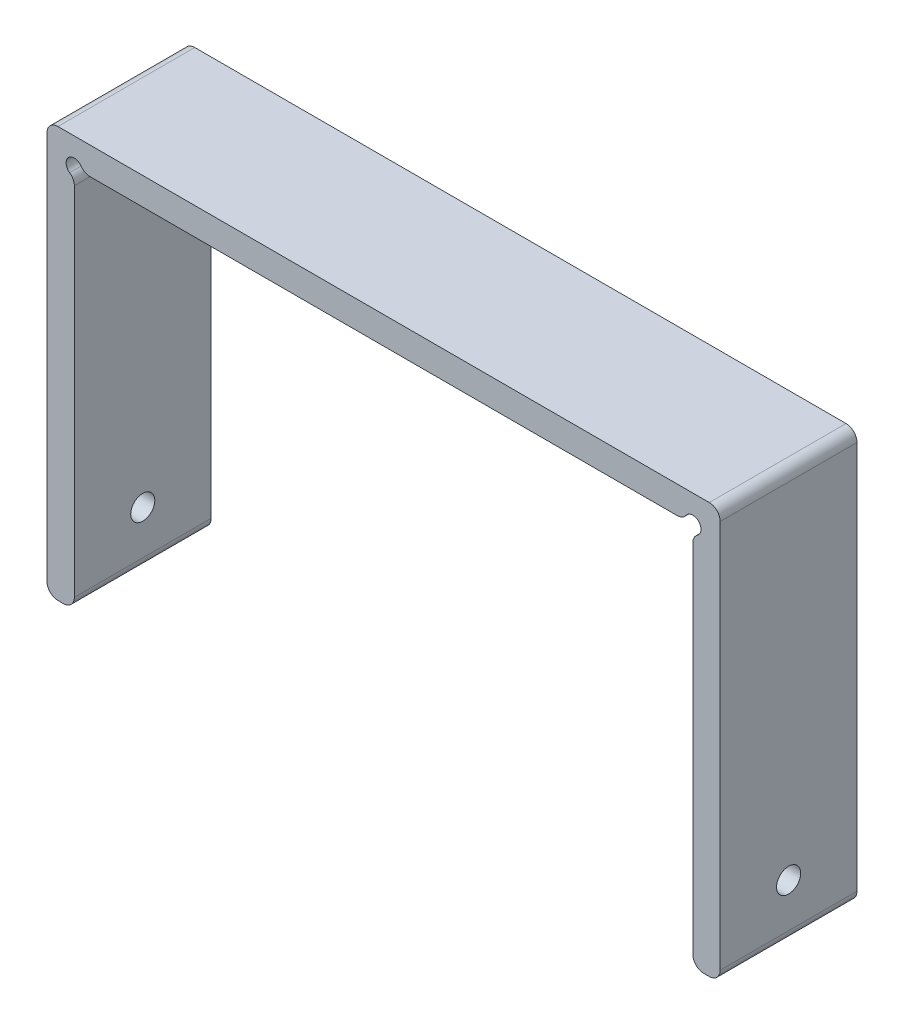
from build123d import *

# Parameters (mm, degrees)
EXTRUDE_1_DEPTH     = 25
SKETCH_2_R          = 2.2
CUT_EXTRUDE_2_DEPTH = 147.215594244
SKETCH_3_R          = 1.5
CUT_EXTRUDE_3_DEPTH = 147.215594244
FILLET_1_R          = 2


with BuildPart() as part:
    # ｽｹｯﾁ1 → ﾎﾞｽ - 押し出し1 (new body)
    with BuildSketch(Plane.XY):
        Polygon((0, 0), (0, 75), (123, 75), (123, 0), (118, 0), (118, 70), (5, 70), (5, 0), align=None)
    extrude(amount=EXTRUDE_1_DEPTH)

    # ｽｹｯﾁ2 → ｶｯﾄ - 押し出し2 (cut, through all)
    with BuildSketch(Plane(origin=(123, 0, 0), x_dir=(0, 0, -1), z_dir=(1, 0, 0))):
        with Locations((-12.5, 10)):
            Circle(SKETCH_2_R)
    extrude(amount=-CUT_EXTRUDE_2_DEPTH, mode=Mode.SUBTRACT)

    # ｽｹｯﾁ3 → ｶｯﾄ - 押し出し3 (cut, through all)
    with BuildSketch(Plane.XY.offset(25)):
        with Locations((5, 70)):
            Circle(SKETCH_3_R)
        with Locations((118, 70)):
            Circle(SKETCH_3_R)
    extrude(amount=-CUT_EXTRUDE_3_DEPTH, mode=Mode.SUBTRACT)

    # ﾌｨﾚｯﾄ1
    fillet_1_edges = [part.edges().sort_by_distance(p)[0] for p in [
        (0, 0, 12.5),
        (0, 75, 12.5),
        (123, 75, 12.5),
        (123, 0, 12.5),
        (118, 0, 12.5),
        (5, 0, 12.5),
        (5, 68.5, 12.5),
        (6.5, 70, 12.5),
        (116.5, 70, 12.5),
        (118, 68.5, 12.5),
    ]]
    fillet(fillet_1_edges, radius=FILLET_1_R)


solid = part.part
